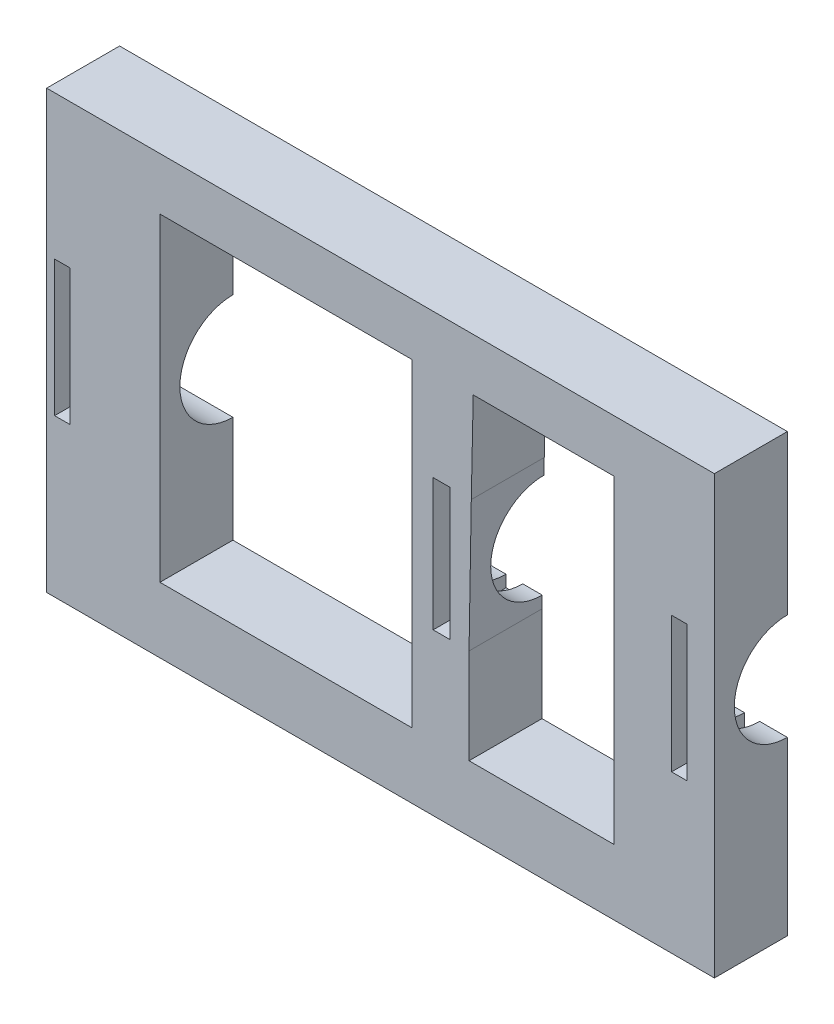
from build123d import *

# Parameters (mm, degrees)
BOSS_EXTRUDE1_DEPTH     = 13.1572
BOSS_EXTRUDE2_DEPTH     = 8.89
SKETCH3_W               = 66.04
SKETCH3_H               = 20.285187831
BOSS_EXTRUDE3_DEPTH     = 5.08
BOSS_EXTRUDE4_DEPTH     = 8.89
CUT_EXTRUDE1_DEPTH      = 64.71104446
CUT_EXTRUDE1_DEPTH_BACK = 64.71104446
SKETCH6_R               = 5.1435
SKETCH7_W               = 66.04
SKETCH7_H               = 20.285187831
BOSS_EXTRUDE5_DEPTH     = 25.4
SKETCH9_W               = 1.615391333
SKETCH9_H               = 12.791830428
BOSS_EXTRUDE6_DEPTH     = 19.05
SKETCH10_R              = 5.08
CUT_EXTRUDE2_DEPTH      = 15.24
CUT_EXTRUDE3_DEPTH      = 1.27
SKETCH14_W              = 1.4732
SKETCH14_H              = 13.1572
CUT_EXTRUDE4_DEPTH      = 15.24
SKETCH15_W              = 64.77
SKETCH15_H              = 20.285187831
CUT_EXTRUDE5_DEPTH      = 19.05
BOSS_EXTRUDE7_DEPTH     = 1.4986
SKETCH17_W              = 64.77
SKETCH17_H              = 42.3672
CUT_EXTRUDE7_DEPTH      = 13.208


with BuildPart() as part:
    # Sketch1 → Boss-Extrude1 (new body)
    with BuildSketch(Plane(origin=(0, 0, 0), x_dir=(1, 0, 0), z_dir=(0, 1, 0))):
        Polygon((3.949839476, 3.210057439), (3.949839476, 17.1069), (0, 17.1069), (0, 0), (0, -3.178287831), (66.04, -3.178287831), (66.04, 0), (66.04, 17.1069), (62.090160524, 17.1069), (62.090160524, 3.210057439), (60.616960524, 3.210057439), (60.616960524, 17.1069), (55.050578368, 17.1069), (55.050578368, 3.210057439), (55.050578368, 0), (10.989421632, 0), (10.989421632, 3.210057439), (10.989421632, 17.1069), (5.423039476, 17.1069), (5.423039476, 3.210057439), align=None)
    extrude(amount=BOSS_EXTRUDE1_DEPTH)

    # Sketch2 → Boss-Extrude2 (add)
    with BuildSketch(Plane(origin=(0, 13.1572, 0), x_dir=(1, 0, 0), z_dir=(0, 1, 0))):
        Polygon((10.989421632, 17.1069), (0, 17.1069), (0, -3.178287831), (66.04, -3.178287831), (66.04, 17.1069), (55.050578368, 17.1069), (55.050578368, -0.226283794), (10.989421632, 0), align=None)
    extrude(amount=BOSS_EXTRUDE2_DEPTH)

    # Sketch3 → Boss-Extrude3 (add)
    with BuildSketch(Plane(origin=(0, 22.0472, 0), x_dir=(1, 0, 0), z_dir=(0, 1, 0))):
        with Locations((33.02, 6.964306084)):
            Rectangle(SKETCH3_W, SKETCH3_H)
    extrude(amount=BOSS_EXTRUDE3_DEPTH)

    # Sketch4 → Boss-Extrude4 (add)
    with BuildSketch(Plane.XZ):
        Polygon((66.04, -17.1069), (55.050578368, -17.1069), (55.050578368, 0), (10.989421632, 0), (10.989421632, -17.1069), (0, -17.1069), (0, 3.178287831), (66.04, 3.178287831), align=None)
    extrude(amount=BOSS_EXTRUDE4_DEPTH)

    # Sketch6 → Cut-Extrude1 (cut, two sides: drawn at the far end of the back side and taken through both)
    with BuildSketch(Plane.ZY.offset(-55.050578368).offset(-CUT_EXTRUDE1_DEPTH_BACK)):
        with Locations((-17.1069, 6.5786)):
            Circle(SKETCH6_R)
    extrude(amount=CUT_EXTRUDE1_DEPTH + CUT_EXTRUDE1_DEPTH_BACK, mode=Mode.SUBTRACT)

    # Sketch7 → Boss-Extrude5 (add)
    with BuildSketch(Plane.XZ.offset(8.89)):
        with Locations((33.02, -6.964306084)):
            Rectangle(SKETCH7_W, SKETCH7_H)
    extrude(amount=BOSS_EXTRUDE5_DEPTH)

    # Sketch9 → Boss-Extrude6 (add)
    with BuildSketch(Plane(origin=(0, 0, -17.1069), x_dir=(-1, 0, 0), z_dir=(0, 0, -1))):
        Polygon((-41.375896334, 22.0472), (-41.18906329, 13.1572), (-40.971249817, 0.333691876), (-40.971249817, -8.89), (-37.490871957, -8.89), (-35.458871957, -8.89), (-35.458871957, 13.1572), (-35.458871957, 22.0472), align=None)
        with Locations((-38.298567624, 6.761284786)):
            Rectangle(SKETCH9_W, SKETCH9_H, mode=Mode.SUBTRACT)
    extrude(amount=-BOSS_EXTRUDE6_DEPTH)

    # Sketch10 → Cut-Extrude2 (cut)
    with BuildSketch(Plane.ZY.offset(-35.458871957)):
        with Locations((-17.1069, 6.5786)):
            Circle(SKETCH10_R)
    extrude(amount=-CUT_EXTRUDE2_DEPTH, mode=Mode.SUBTRACT)

    # Sketch12 → Cut-Extrude3 (cut)
    with BuildSketch(Plane(origin=(66.04, 0, 0), x_dir=(0, 0, -1), z_dir=(1, 0, 0))):
        Polygon((17.1069, 27.1272), (17.1069, 11.7221), (17.1069, 1.4351), (17.1069, -34.29), (-3.178287831, -34.29), (-3.52610715, 27.1272), align=None)
    extrude(amount=-CUT_EXTRUDE3_DEPTH, mode=Mode.SUBTRACT)

    # Sketch14 → Cut-Extrude4 (cut)
    with BuildSketch(Plane(origin=(0, 0, -17.1069), x_dir=(-1, 0, 0), z_dir=(0, 0, -1))):
        with Locations((-4.686439476, 6.5786)):
            Rectangle(SKETCH14_W, SKETCH14_H)
        with Locations((-1.511439476, 6.5786)):
            Rectangle(SKETCH14_W, SKETCH14_H)
    extrude(amount=-CUT_EXTRUDE4_DEPTH, mode=Mode.SUBTRACT)

    # Sketch15 → Cut-Extrude5 (cut)
    with BuildSketch(Plane.XZ.offset(34.29)):
        with Locations((32.385, -6.964306084)):
            Rectangle(SKETCH15_W, SKETCH15_H)
    extrude(amount=-CUT_EXTRUDE5_DEPTH, mode=Mode.SUBTRACT)

    # Sketch16 → Boss-Extrude7 (add)
    with BuildSketch(Plane.ZY.offset(-5.423039476)):
        with BuildLine():
            Line((-17.1069, 13.1572), (6.075816752, 13.1572))
            Line((6.075816752, 13.1572), (6.075816752, 0))
            Line((6.075816752, 0), (-17.1069, 0))
            Line((-17.1069, 0), (-17.1069, 1.4351))
            ThreePointArc((-17.1069, 1.4351), (-11.9634, 6.5786), (-17.1069, 11.7221))
            Line((-17.1069, 11.7221), (-17.1069, 13.1572))
        make_face()
    extrude(amount=BOSS_EXTRUDE7_DEPTH)

    # Sketch17 → Cut-Extrude7 (cut)
    with BuildSketch(Plane.XY.offset(3.178287831)):
        with Locations((32.385, 5.9436)):
            Rectangle(SKETCH17_W, SKETCH17_H)
    extrude(amount=-CUT_EXTRUDE7_DEPTH, mode=Mode.SUBTRACT)


with BuildPart() as body_2:
    # of the pieces the cut leaves, the one that is kept (cut_extrude7_keep)
    add(part.part.solids().sort_by_distance((10.989421632, 11.7221, -17.1069))[0])


solid = body_2.part
